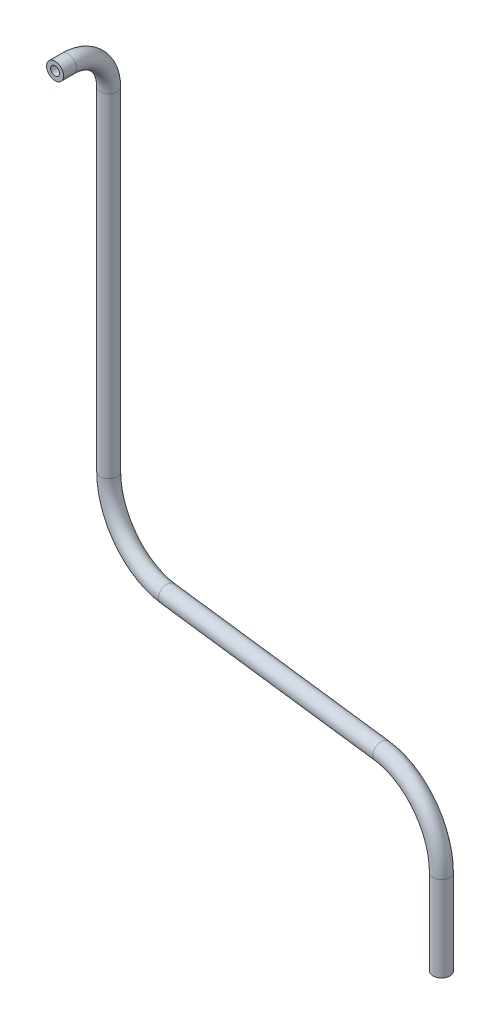
from build123d import *

# Parameters (mm, degrees)
SKETCH1_R   = 3.175
SKETCH1_R_2 = 1.674497635


with BuildPart() as part:
    # Sweep1: sweep along a curve in space
    with BuildLine() as sweep1_path:
        Line((-318.46337649, 190.276422232, 87.147048854), (-318.46337649, 190.276422232, 82.289671471))
        ThreePointArc((-318.46337649, 175.036422232, 67.049671471), (-318.46337649, 185.812729577, 71.513364125), (-318.46337649, 190.276422232, 82.289671471))
        Line((-318.46337649, 175.036422232, 67.049671471), (-318.46337649, 50.132708358, 67.049671471))
        ThreePointArc((-318.46337649, 50.132708358, 67.049671471), (-311.076828746, 32.172196116, 67.93561194), (-293.244125002, 24.732708358, 70.074461437))
        Line((-201.966627979, 24.732708358, 81.022258887), (-293.244125002, 24.732708358, 70.074461437))
        ThreePointArc((-176.74737649, -0.667291642, 84.047048854), (-184.133924235, 17.2932206, 83.161108384), (-201.966627979, 24.732708358, 81.022258887))
        Line((-176.74737649, -32.605577768, 84.047048854), (-176.74737649, -0.667291642, 84.047048854))
    # Sketch1 → Sweep1 (sweep)
    with BuildSketch(Plane(origin=(-176.74737649, -32.605577768, 84.047048854), x_dir=(1, 0, 0), z_dir=(0, 1, 0))):
        Circle(SKETCH1_R)
        Circle(SKETCH1_R_2, mode=Mode.SUBTRACT)
    sweep(path=sweep1_path.line)


solid = part.part
